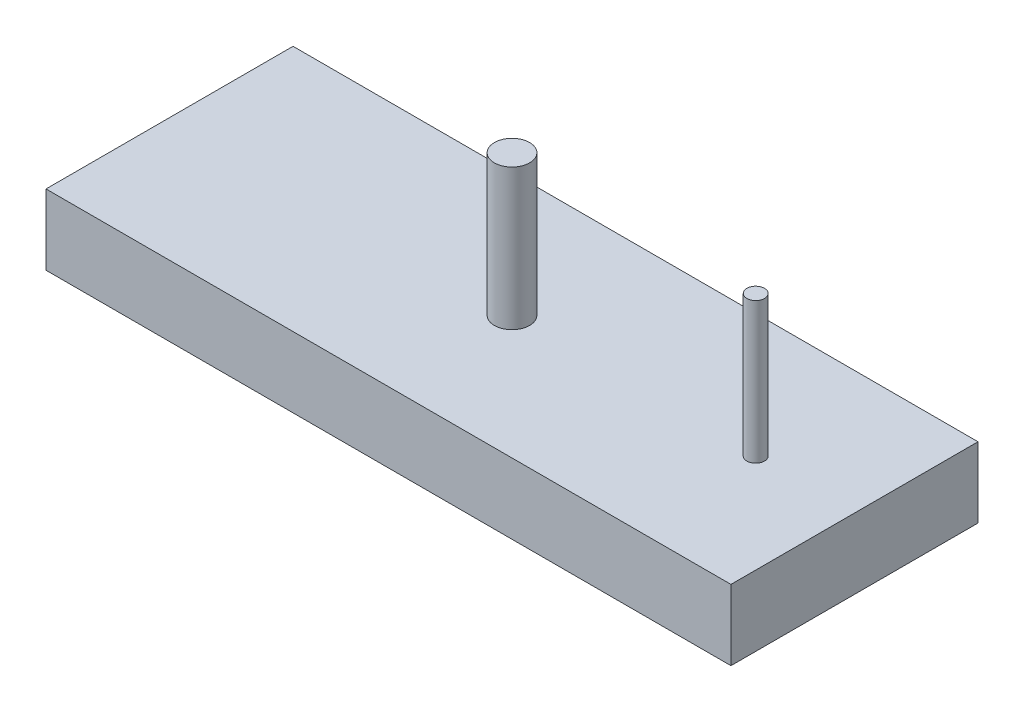
from build123d import *

# Parameters (mm, degrees)
SKETCH_1_W      = 97.254240192
SKETCH_1_H      = 35.07830086
EXTRUDE_1_DEPTH = 10
SKETCH_2_R      = 2.5
SKETCH_2_R_2    = 1.25
EXTRUDE_2_DEPTH = 20


with BuildPart() as part:
    # 草圖1 → 填料-伸長1 (new body)
    with BuildSketch(Plane(origin=(0, 0, 0), x_dir=(1, 0, 0), z_dir=(0, 1, 0))):
        Rectangle(SKETCH_1_W, SKETCH_1_H)
    extrude(amount=EXTRUDE_1_DEPTH)

    # 草圖2 → 填料-伸長2 (add)
    with BuildSketch(Plane(origin=(0, 10, 0), x_dir=(1, 0, 0), z_dir=(0, 1, 0))):
        with Locations(Location((0, 0, 0), (0, 0, 270))):
            Circle(SKETCH_2_R)
        with Locations(Location((34.6, 0, 0), (0, 0, 270))):
            Circle(SKETCH_2_R_2)
    extrude(amount=EXTRUDE_2_DEPTH)


solid = part.part
